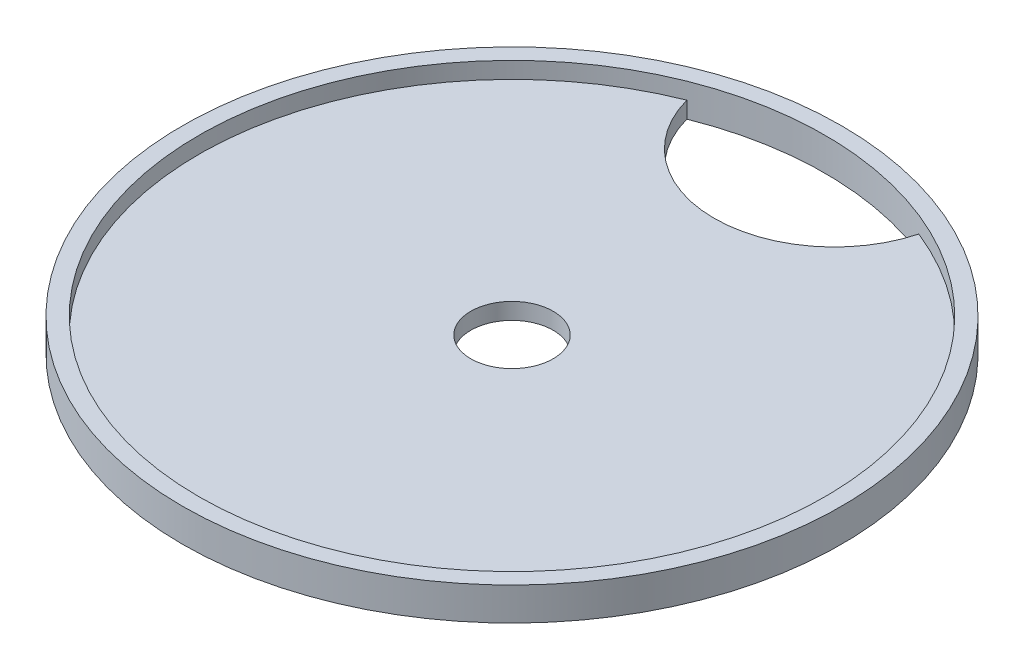
from build123d import *

# Parameters (mm, degrees)
SKETCH1_R           = 40
BOSS_EXTRUDE1_DEPTH = 40
SKETCH2_R           = 38
CUT_EXTRUDE1_DEPTH  = 38
CUT_EXTRUDE2_DEPTH  = 38
SKETCH4_R           = 5
CUT_EXTRUDE3_DEPTH  = 38
SKETCH6_R           = 2
BOSS_EXTRUDE2_DEPTH = 2
SKETCH8_R           = 43.496918112
CUT_EXTRUDE4_DEPTH  = 36


with BuildPart() as part:
    # Sketch1 → Boss-Extrude1 (new body)
    with BuildSketch(Plane(origin=(0, 0, 0), x_dir=(1, 0, 0), z_dir=(0, 1, 0))):
        with Locations(Location((0, 0, 0), (0, 0, 270))):
            Circle(SKETCH1_R)
    extrude(amount=BOSS_EXTRUDE1_DEPTH)

    # Sketch2 → Cut-Extrude1 (cut)
    with BuildSketch(Plane(origin=(0, 40, 0), x_dir=(1, 0, 0), z_dir=(0, 1, 0))):
        with Locations(Location((0, 0, 0), (0, 0, 270))):
            Circle(SKETCH2_R)
    extrude(amount=-CUT_EXTRUDE1_DEPTH, mode=Mode.SUBTRACT)

    # Sketch3 → Cut-Extrude2 (cut)
    with BuildSketch(Plane(origin=(0, 2, 0), x_dir=(1, 0, 0), z_dir=(0, 1, 0))):
        with BuildLine():
            ThreePointArc((-14.076066703, 35.296803626), (0, 24.534862453), (14.076066703, 35.296803626))
            ThreePointArc((14.076066703, 35.296803626), (0, 38), (-14.076066703, 35.296803626))
        make_face()
    extrude(amount=-CUT_EXTRUDE2_DEPTH, mode=Mode.SUBTRACT)

    # Sketch4 → Cut-Extrude3 (cut)
    with BuildSketch(Plane(origin=(0, 2, 0), x_dir=(1, 0, 0), z_dir=(0, 1, 0))):
        with Locations(Location((0, 0, 0), (0, 0, 270))):
            Circle(SKETCH4_R)
    extrude(amount=-CUT_EXTRUDE3_DEPTH, mode=Mode.SUBTRACT)

    # Sketch6 → Boss-Extrude2 (add)
    with BuildSketch(Plane.XZ):
        with Locations(Location((-20, 0, 0), (0, 0, 90))):
            Circle(SKETCH6_R)
        with Locations(Location((20, 0, 0), (0, 0, 90))):
            Circle(SKETCH6_R)
    extrude(amount=BOSS_EXTRUDE2_DEPTH)

    # Sketch8 → Cut-Extrude4 (cut)
    with BuildSketch(Plane(origin=(0, 40, 0), x_dir=(1, 0, 0), z_dir=(0, 1, 0))):
        Circle(SKETCH8_R)
    extrude(amount=-CUT_EXTRUDE4_DEPTH, mode=Mode.SUBTRACT)


solid = part.part
